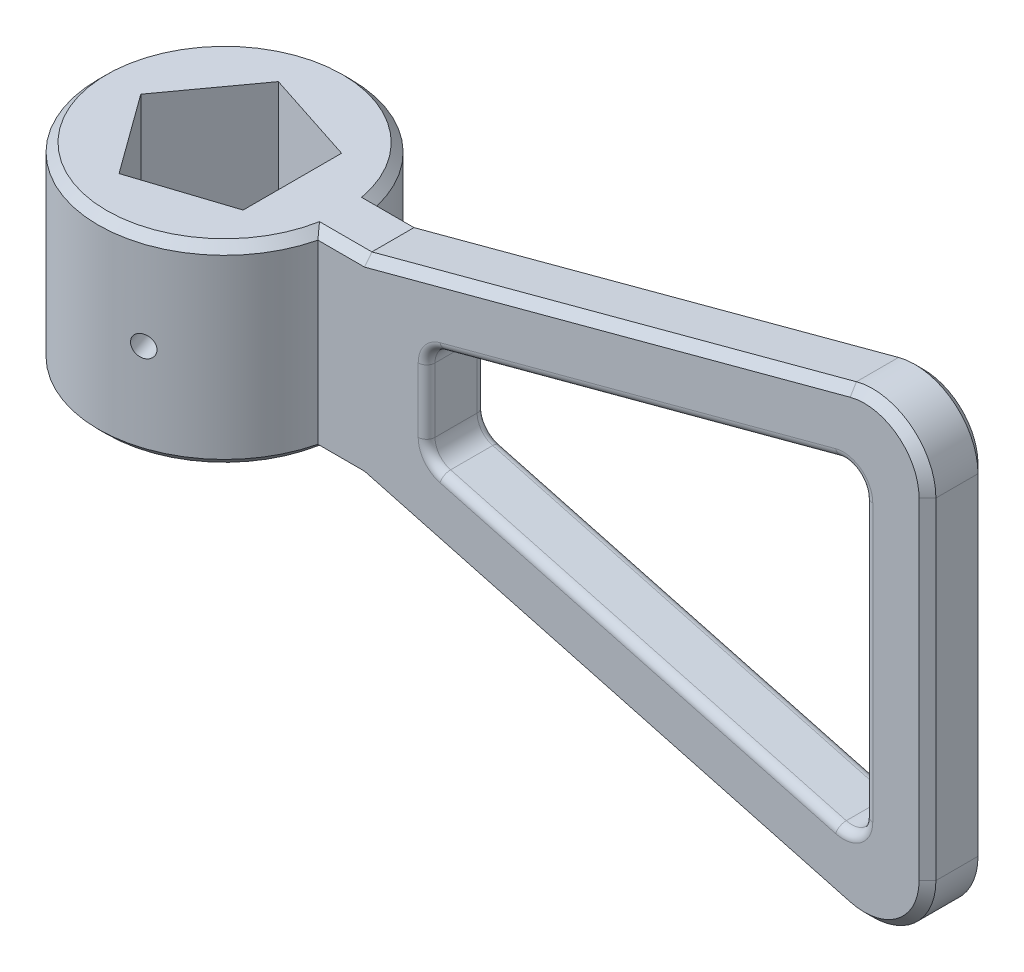
from build123d import *

# Parameters (mm, degrees)
BOSS_EXTRUDE2_DEPTH     = 7
SKETCH2_R               = 30
BOSS_EXTRUDE4_DEPTH     = 23
CUT_EXTRUDE1_DEPTH      = 46
CUT_EXTRUDE2_REACH      = 185.241
CUT_EXTRUDE2_END_RADIUS = 30
SKETCH4_R               = 2.5
FILLET1_R               = 5
CHAMFER1_SIZE           = 2
FILLET2_R               = 2


with BuildPart() as part:
    # Sketch1 → Boss-Extrude2 (new, symmetric)
    with BuildSketch(Plane.XY):
        with BuildLine():
            Line((174, -39.356811193), (174, 39.356811193))
            ThreePointArc((174, 39.356811193), (168.131421435, 51.257111298), (155.117714323, 53.845698587))
            Line((155.117714323, 53.845698587), (40, 23))
            Line((40, 23), (30, 23))
            Line((30, 23), (0, 23))
            Line((0, 23), (0, -23))
            Line((0, -23), (30, -23))
            Line((30, -23), (40, -23))
            Line((40, -23), (155.117714323, -53.845698587))
            ThreePointArc((155.117714323, -53.845698587), (168.131421435, -51.257111298), (174, -39.356811193))
        make_face()
        Polygon((159, -39.356811193), (159, 39.356811193), (55, 11.49009518), (55, -11.49009518), align=None, mode=Mode.SUBTRACT)
    extrude(amount=BOSS_EXTRUDE2_DEPTH, both=True)

    # Sketch2 → Boss-Extrude4 (add, symmetric)
    with BuildSketch(Plane(origin=(0, 0, 0), x_dir=(1, 0, 0), z_dir=(0, 1, 0))):
        Circle(SKETCH2_R)
    extrude(amount=BOSS_EXTRUDE4_DEPTH, both=True)

    # Sketch3 → Cut-Extrude1 (cut)
    with BuildSketch(Plane(origin=(0, 23, 0), x_dir=(1, 0, 0), z_dir=(0, 1, 0))):
        Polygon((16.099689438, 11.697109064), (-6.149534157, 18.926320036), (-19.900310562, 0), (-6.149534157, -18.926320036), (16.099689438, -11.697109064), align=None)
    extrude(amount=-CUT_EXTRUDE1_DEPTH, mode=Mode.SUBTRACT)

    # Cut-Extrude2: up to this cylinder (the profile starts inside it)
    cut_extrude2_end = Plane(origin=(0, 0, 0), z_dir=(0, -1, 0)) * Cylinder(CUT_EXTRUDE2_END_RADIUS, 431.482, mode=Mode.PRIVATE)
    # Sketch4 → Cut-Extrude2 (cut, up to the surface)
    with BuildSketch(Plane(origin=(4.975077641, 0, 15.31171455), x_dir=(-0.9510565162951536, 0, 0.30901699437494745), z_dir=(-0.3090169943749474, 0, -0.9510565162951535)), mode=Mode.PRIVATE) as cut_extrude2_sk1:
        Circle(SKETCH4_R)
    cut_extrude2_tool1 = extrude(cut_extrude2_sk1.sketch, amount=-CUT_EXTRUDE2_REACH, mode=Mode.PRIVATE) & cut_extrude2_end
    add(cut_extrude2_tool1.solids().sort_by_distance((4.975078, 0, 15.311715))[0], mode=Mode.SUBTRACT)

    # Fillet1
    fillet1_edges = [part.edges().sort_by_distance(p)[0] for p in [
        (55, -11.49009518, 0),
        (159, -39.356811193, 0),
        (159, 39.356811193, 0),
        (55, 11.49009518, 0),
    ]]
    fillet(fillet1_edges, radius=FILLET1_R)

    # Chamfer1
    chamfer1_edges = [part.edges().sort_by_distance(p)[0] for p in [
        (34.585952146, 23, 7),
        (97.558857162, -38.422849294, -7),
        (34.585952146, 23, -7),
        (97.558857162, 38.422849294, -7),
        (168.131421435, 51.257111298, -7),
        (97.558857162, -38.422849294, 7),
        (168.131421435, -51.257111298, 7),
        (174, 0, 7),
        (168.131421435, 51.257111298, 7),
        (34.585952146, -23, -7),
        (34.585952146, -23, 7),
        (-30, -23, 0),
        (-30, 23, 0),
        (97.558857162, 38.422849294, 7),
        (174, 0, -7),
        (168.131421435, -51.257111298, -7),
    ]]
    chamfer(chamfer1_edges, length=CHAMFER1_SIZE)

    # Fillet2
    fillet2_edges = [part.edges().sort_by_distance(p)[0] for p in [
        (105.705904774, -25.076701416, -7),
        (105.705904774, -25.076701416, 7),
        (159, 0, -7),
        (159, 0, 7),
        (105.705904774, 25.076701416, -7),
        (105.705904774, 25.076701416, 7),
        (55, 0, -7),
        (55, 0, 7),
        (157.043807145, -36.80745103, -7),
        (157.043807145, -36.80745103, 7),
        (157.043807145, 36.80745103, -7),
        (157.043807145, 36.80745103, 7),
        (56.033233299, -10.697267385, -7),
        (56.033233299, -10.697267385, 7),
        (56.033233299, 10.697267385, -7),
        (56.033233299, 10.697267385, 7),
    ]]
    fillet(fillet2_edges, radius=FILLET2_R)


solid = part.part
